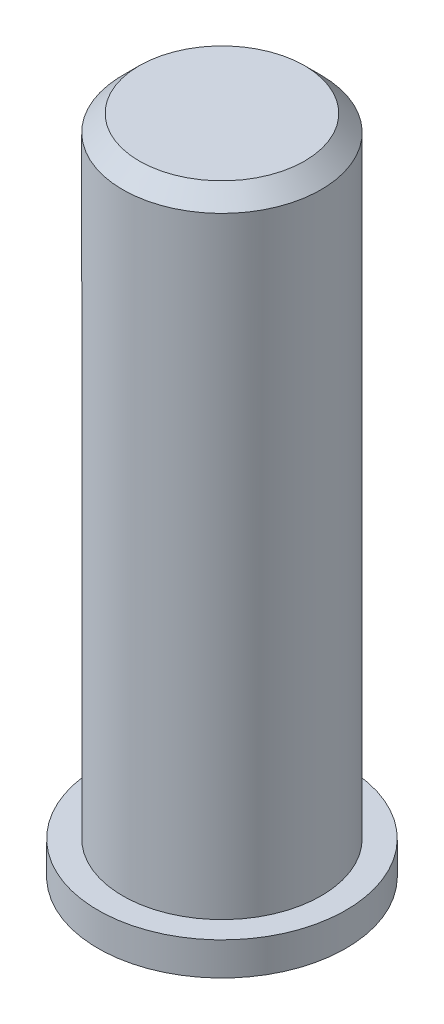
from build123d import *

# Parameters (mm, degrees)
SKETCH_1_R      = 3
EXTRUDE_1_DEPTH = 20
CHAMFER_1_SIZE  = 0.5
SKETCH_2_R      = 3.75
EXTRUDE_2_DEPTH = 1
SKETCH_3_R      = 0.375
EXTRUDE_3_DEPTH = 0.8


with BuildPart() as part:
    # Эскиз1 → Вытянуть1 (new body)
    with BuildSketch(Plane(origin=(0, 0, 0), x_dir=(1, 0, 0), z_dir=(0, 1, 0))):
        with Locations(Location((0, 0, 0), (0, 0, 270))):
            Circle(SKETCH_1_R)
    extrude(amount=EXTRUDE_1_DEPTH)

    # Фаска1
    chamfer_1_edges = [part.edges().sort_by_distance(p)[0] for p in [
        (0, 20, -3),
    ]]
    chamfer(chamfer_1_edges, length=CHAMFER_1_SIZE)

    # Эскиз2 → Вытянуть2 (add)
    with BuildSketch(Plane.XZ):
        with Locations(Location((0, 0, 0), (0, 0, 270))):
            Circle(SKETCH_2_R)
    extrude(amount=-EXTRUDE_2_DEPTH)

    # Эскиз3 → Вытянуть3 (add)
    with BuildSketch(Plane.XZ):
        with Locations(Location((0, 0, 0), (0, 0, 90))):
            Circle(SKETCH_3_R)
    extrude(amount=EXTRUDE_3_DEPTH)


solid = part.part
